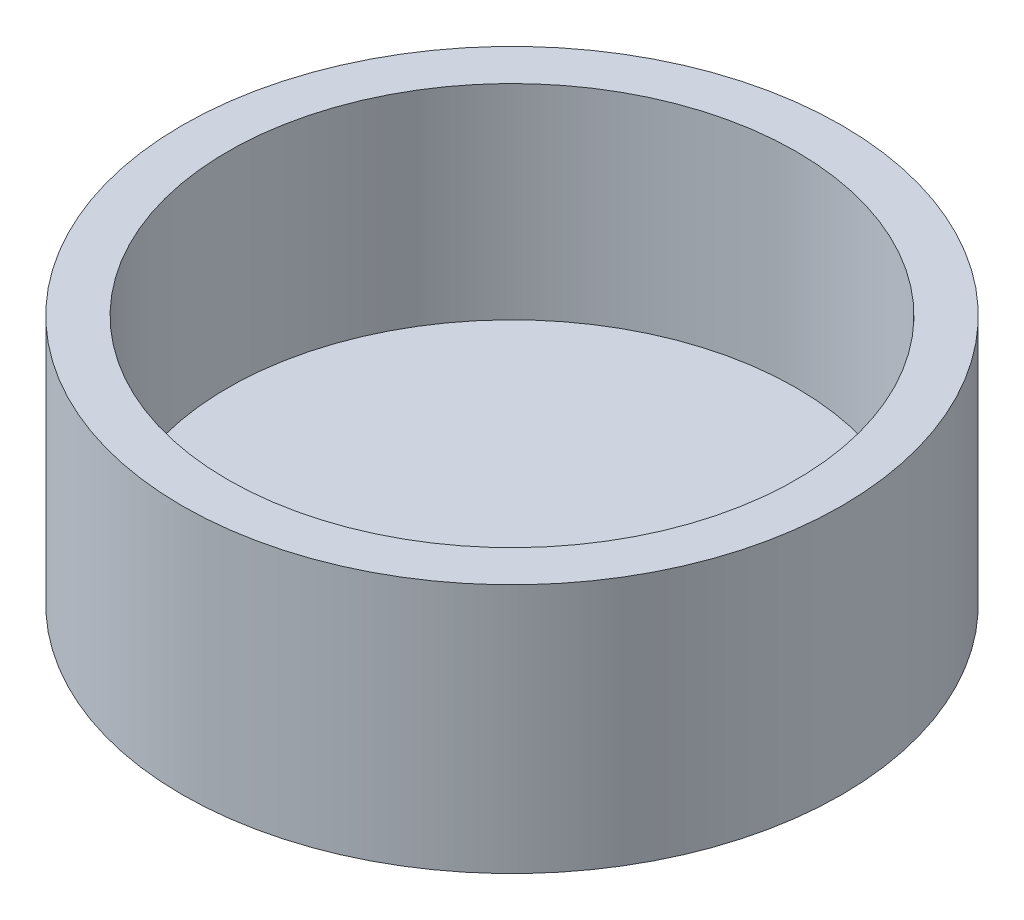
from build123d import *

# Parameters (mm, degrees)
SKETCH1_R           = 31.75
BOSS_EXTRUDE2_DEPTH = 22.86
SHELL3_T            = 5.08


with BuildPart() as part:
    # Sketch1 → Boss-Extrude2 (new body)
    with BuildSketch(Plane(origin=(0, 0, 0), x_dir=(1, 0, 0), z_dir=(0, 1, 0))):
        with Locations(Location((0, 0, 0), (0, 0, 270))):
            Circle(SKETCH1_R)
    extrude(amount=BOSS_EXTRUDE2_DEPTH)

    # Shell3
    shell3_openings = [part.faces().sort_by_distance(p)[0] for p in [
        (0, 22.86, 0),
    ]]
    offset(amount=SHELL3_T, openings=shell3_openings, kind=Kind.INTERSECTION)


solid = part.part
